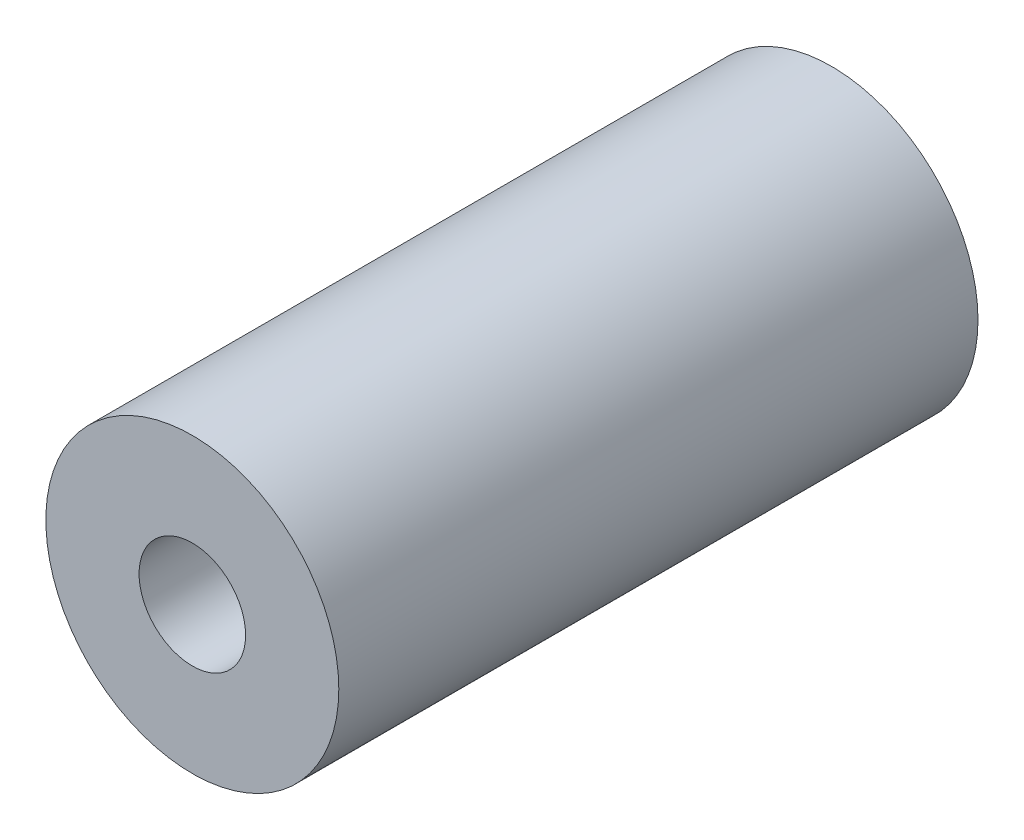
from build123d import *

# Parameters (mm, degrees)
SKETCH1_R           = 2.75
SKETCH1_R_2         = 1
BOSS_EXTRUDE1_DEPTH = 12


with BuildPart() as part:
    # Sketch1 → Boss-Extrude1 (new body)
    with BuildSketch(Plane.XY):
        Circle(SKETCH1_R)
        Circle(SKETCH1_R_2, mode=Mode.SUBTRACT)
    extrude(amount=BOSS_EXTRUDE1_DEPTH)


solid = part.part
